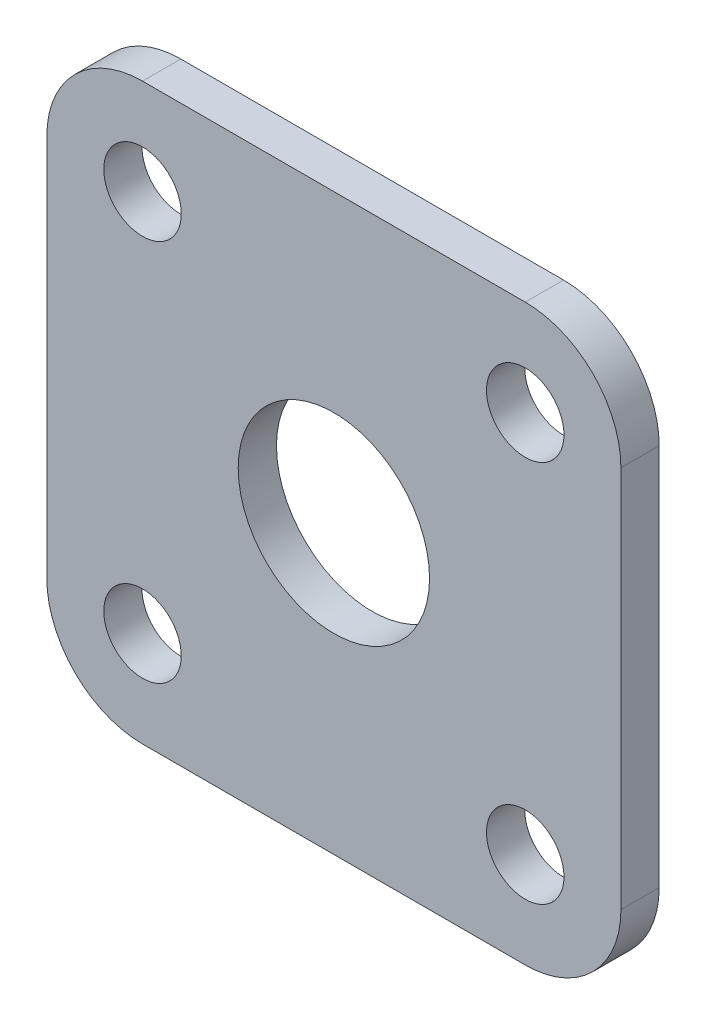
from build123d import *

# Parameters (mm, degrees)
SKETCH1_R           = 2.025
SKETCH1_R_2         = 5
BOSS_EXTRUDE1_DEPTH = 2


with BuildPart() as part:
    # Sketch1 → Boss-Extrude1 (new body)
    with BuildSketch(Plane.XY):
        with BuildLine():
            Line((-10, 15), (10, 15))
            ThreePointArc((10, 15), (13.535533906, 13.535533906), (15, 10))
            Line((15, 10), (15, -10))
            ThreePointArc((15, -10), (13.535533906, -13.535533906), (10, -15))
            Line((10, -15), (-10, -15))
            ThreePointArc((-10, -15), (-13.535533906, -13.535533906), (-15, -10))
            Line((-15, -10), (-15, 10))
            ThreePointArc((-15, 10), (-13.535533906, 13.535533906), (-10, 15))
        make_face()
        with Locations((-10, 10)):
            Circle(SKETCH1_R, mode=Mode.SUBTRACT)
        with Locations((10, 10)):
            Circle(SKETCH1_R, mode=Mode.SUBTRACT)
        with Locations((10, -10)):
            Circle(SKETCH1_R, mode=Mode.SUBTRACT)
        with Locations((-10, -10)):
            Circle(SKETCH1_R, mode=Mode.SUBTRACT)
        Circle(SKETCH1_R_2, mode=Mode.SUBTRACT)
    extrude(amount=BOSS_EXTRUDE1_DEPTH)


solid = part.part
